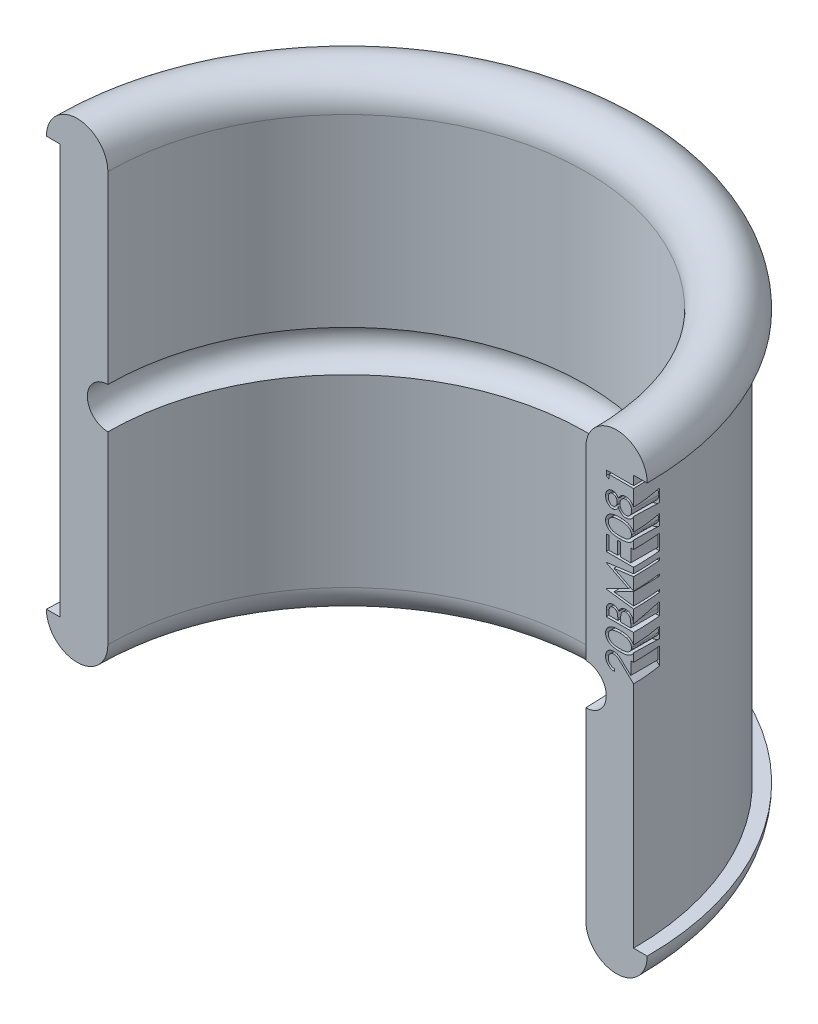
from build123d import *

# Parameters (mm, degrees)
REVOLVE2_ANGLE     = 180
CUT_EXTRUDE1_DEPTH = 2


with BuildPart() as part:
    # Sketch2 → Revolve2 (revolve)
    with BuildSketch(Plane.XY):
        with BuildLine():
            Line((2.25, 1.5), (2.25, 15))
            ThreePointArc((2.25, 15), (0, 17.25), (-2.25, 15))
            Line((-2.25, 15), (-1.25, 15))
            Line((-1.25, 15), (-1.25, -15))
            Line((-1.25, -15), (-2.25, -15))
            ThreePointArc((-2.25, -15), (0, -17.25), (2.25, -15))
            Line((2.25, -15), (2.25, -1.5))
            ThreePointArc((2.25, -1.5), (0.75, 0), (2.25, 1.5))
        make_face()
    revolve(axis=Axis((19.75, 15, 0), (0, -1, 0)), revolution_arc=REVOLVE2_ANGLE)

    # Sketch3 → Cut-Extrude1 (cut)
    # profile 1 of 8: a face of its own
    with BuildSketch(Plane.XY):
        Polygon((38.75, 13.963541667), (38.75, 14.333333333), (40.75, 14.333333333), (40.75, 14.153846154), (38.955128205, 14.153846154), (38.955128205, 13.846153846), align=None)
    # profile 2 of 8: a face of its own
    with BuildSketch(Plane.XY):
        with BuildLine():
            add(Edge.make_bspline(
                [(39.635817308, 12.972355769), (39.64434117, 12.988734612), (39.660965548, 13.020678826), (39.687901675, 13.065973436), (39.715558617, 13.107942106), (39.744464782, 13.146355068), (39.773973157, 13.181703774), (39.804463295, 13.213466849), (39.835893971, 13.241778532), (39.868381413, 13.266593709), (39.901931334, 13.288555101), (39.936757023, 13.307185161), (39.972388611, 13.32343743), (40.009358204, 13.336195151), (40.047160961, 13.346727636), (40.086303507, 13.353969282), (40.126522903, 13.357865083), (40.153704821, 13.358601491), (40.167467949, 13.358974359)],
                knots=[0, 0, 0, 0, 1.272232798, 2.48127884, 3.629933602, 4.734339846, 5.792529071, 6.8014233, 7.765980239, 8.70477066, 9.616091719, 10.526157162, 11.424183119, 12.311964017, 13.218439077, 14.126407968, 15.05133675, 16, 16, 16, 16], degree=3))
            add(Edge.make_bspline(
                [(40.167467949, 13.358974359), (40.186723313, 13.358532114), (40.224836905, 13.357656745), (40.281098843, 13.350077594), (40.335832969, 13.338595165), (40.388933056, 13.322245789), (40.43989639, 13.300397033), (40.489017721, 13.273972811), (40.53713485, 13.243888868), (40.566747057, 13.219747521), (40.581730769, 13.207532051)],
                knots=[0, 0, 0, 0, 1.025234619, 2.029323995, 3.018511574, 4.001747246, 4.983437759, 5.966776356, 6.971193253, 8, 8, 8, 8], degree=3))
            add(Edge.make_bspline(
                [(40.581730769, 13.207532051), (40.599212926, 13.191625495), (40.633961207, 13.160008943), (40.679075956, 13.10584727), (40.716989895, 13.046406193), (40.747888121, 12.981915718), (40.771937183, 12.912548231), (40.789218622, 12.838318514), (40.799117153, 12.759081855), (40.800548004, 12.704621586), (40.801282051, 12.676682692)],
                knots=[0, 0, 0, 0, 0.954267603, 1.896743057, 2.838368354, 3.796610408, 4.779680527, 5.799409237, 6.871065594, 8, 8, 8, 8], degree=3))
            add(Edge.make_bspline(
                [(40.801282051, 12.676682692), (40.800623492, 12.649817899), (40.799342004, 12.59754174), (40.790659472, 12.521451523), (40.775443547, 12.450524058), (40.75461806, 12.384346922), (40.727526485, 12.323319135), (40.693807454, 12.267614371), (40.654817838, 12.216429739), (40.60943919, 12.171315615), (40.560831684, 12.131271831), (40.510698567, 12.096066139), (40.459078461, 12.066968587), (40.406756018, 12.041888877), (40.352671215, 12.023224695), (40.297379048, 12.009986827), (40.241036607, 12.001671599), (40.203019608, 12.000559479), (40.183894231, 12)],
                knots=[0, 0, 0, 0, 1.25688423, 2.445769047, 3.576901867, 4.645929967, 5.686364546, 6.692558921, 7.686102643, 8.689032542, 9.678639083, 10.630214757, 11.550908986, 12.44815258, 13.341318614, 14.221806242, 15.105436345, 16, 16, 16, 16], degree=3))
            add(Edge.make_bspline(
                [(40.183894231, 12), (40.169860449, 12.000330315), (40.142124743, 12.000983133), (40.101147373, 12.005498789), (40.061266129, 12.012765953), (40.022320195, 12.022609315), (39.984527671, 12.03608789), (39.947646416, 12.052020247), (39.911918272, 12.070961056), (39.877078506, 12.092705242), (39.843542965, 12.118020095), (39.810770369, 12.146705514), (39.779172802, 12.1791438), (39.74893235, 12.2155667), (39.718484964, 12.254695304), (39.690085937, 12.298184642), (39.661586421, 12.344653504), (39.644554393, 12.377686271), (39.635817308, 12.39463141)],
                knots=[0, 0, 0, 0, 0.941515718, 1.860767376, 2.762381872, 3.659935523, 4.55260077, 5.451495189, 6.353332278, 7.263234701, 8.204067976, 9.169206831, 10.183030162, 11.238523545, 12.34427893, 13.507326683, 14.721309093, 16, 16, 16, 16], degree=3))
            add(Edge.make_bspline(
                [(39.635817308, 12.39463141), (39.623130164, 12.371466976), (39.598602716, 12.326684284), (39.554134582, 12.266782035), (39.504920701, 12.216122297), (39.451465746, 12.174664458), (39.394836693, 12.142194508), (39.335504975, 12.119890913), (39.27452231, 12.10480908), (39.232861898, 12.103314643), (39.211939103, 12.102564103)],
                knots=[0, 0, 0, 0, 1.166795445, 2.255709742, 3.287146686, 4.280506455, 5.237809939, 6.161201476, 7.076514059, 8, 8, 8, 8], degree=3))
            add(Edge.make_bspline(
                [(39.211939103, 12.102564103), (39.190627173, 12.10350027), (39.147786478, 12.105382131), (39.083996756, 12.120547355), (39.021308949, 12.145446277), (38.95987701, 12.178738361), (38.902466684, 12.221084006), (38.850734094, 12.271216712), (38.805433037, 12.328732839), (38.767383976, 12.393100787), (38.736423405, 12.462380826), (38.7150639, 12.53547494), (38.701100513, 12.611113091), (38.699519553, 12.662597481), (38.698717949, 12.688701923)],
                knots=[0, 0, 0, 0, 0.888671842, 1.786385383, 2.719922424, 3.697584571, 4.694127107, 5.68736021, 6.695307759, 7.740011808, 8.800474061, 9.853175224, 10.911482437, 12, 12, 12, 12], degree=3))
            add(Edge.make_bspline(
                [(38.698717949, 12.688701923), (38.6995444, 12.714132707), (38.701174066, 12.764279314), (38.714767015, 12.837990067), (38.737467918, 12.90852031), (38.768272617, 12.975616364), (38.806184957, 13.038115619), (38.85214883, 13.093156016), (38.903271186, 13.142177055), (38.961008596, 13.182499068), (39.022204254, 13.21553106), (39.086063548, 13.23878782), (39.151300769, 13.253598889), (39.195435551, 13.255471857), (39.217548077, 13.256410256)],
                knots=[0, 0, 0, 0, 1.072838999, 2.115516285, 3.151283082, 4.193045685, 5.225601509, 6.226687556, 7.21162948, 8.206378771, 9.189883966, 10.138656908, 11.067424936, 12, 12, 12, 12], degree=3))
            add(Edge.make_bspline(
                [(39.217548077, 13.256410256), (39.239246994, 13.25558543), (39.281862435, 13.253965518), (39.343898556, 13.240521617), (39.401867862, 13.217519231), (39.456703744, 13.186521239), (39.507294825, 13.14577105), (39.554703974, 13.096566233), (39.598386925, 13.038391393), (39.623079548, 12.994828046), (39.635817308, 12.972355769)],
                knots=[0, 0, 0, 0, 0.97540661, 1.915643144, 2.83819279, 3.771804602, 4.738123289, 5.749225578, 6.838931607, 8, 8, 8, 8], degree=3))
        make_face()
        with BuildLine():
            add(Edge.make_bspline(
                [(38.903846154, 12.678685897), (38.904217201, 12.664656375), (38.90494313, 12.637208495), (38.908764945, 12.596970408), (38.916106051, 12.558675775), (38.926163269, 12.522115188), (38.938676462, 12.487163404), (38.95516302, 12.45462193), (38.973487899, 12.423397186), (38.994982147, 12.394513528), (39.018432836, 12.368366485), (39.042923388, 12.345012565), (39.069175772, 12.325986369), (39.095876616, 12.309617435), (39.124133405, 12.297461215), (39.153327449, 12.288825855), (39.183643658, 12.282714544), (39.204296375, 12.282274088), (39.21474359, 12.282051282)],
                knots=[0, 0, 0, 0, 1.20353747, 2.354645537, 3.462130888, 4.543058862, 5.604822423, 6.639552563, 7.666902586, 8.706944258, 9.720926464, 10.677177239, 11.602682187, 12.496457588, 13.358248655, 14.231532794, 15.105417644, 16, 16, 16, 16], degree=3))
            add(Edge.make_bspline(
                [(39.21474359, 12.282051282), (39.225189595, 12.282444063), (39.245832403, 12.283220255), (39.276315755, 12.289223185), (39.306270976, 12.298169959), (39.334985782, 12.312256052), (39.363456273, 12.329151114), (39.390970893, 12.350003386), (39.417625399, 12.374854259), (39.44319308, 12.402869939), (39.46713523, 12.433390818), (39.487919905, 12.465724557), (39.505310826, 12.499465352), (39.519784771, 12.534266534), (39.531036164, 12.57048279), (39.539018248, 12.607892203), (39.543979389, 12.646501062), (39.544571972, 12.672661394), (39.544871795, 12.685897436)],
                knots=[0, 0, 0, 0, 0.873023192, 1.725219244, 2.590779336, 3.480155217, 4.391973325, 5.357036234, 6.360879153, 7.436073238, 8.526419356, 9.601555421, 10.645666583, 11.697338044, 12.750135903, 13.812665442, 14.89329948, 16, 16, 16, 16], degree=3))
            add(Edge.make_bspline(
                [(39.544871795, 12.685897436), (39.544375529, 12.702898513), (39.543387899, 12.736732749), (39.534121462, 12.786591601), (39.51972981, 12.835192464), (39.499303461, 12.881615724), (39.474398834, 12.925030515), (39.445029308, 12.964212362), (39.410505164, 12.997521575), (39.372829062, 13.025859239), (39.33286382, 13.048015281), (39.292593574, 13.064987156), (39.25168662, 13.074982092), (39.224275815, 13.076281352), (39.210737179, 13.076923077)],
                knots=[0, 0, 0, 0, 1.076561449, 2.142489767, 3.202892658, 4.283174188, 5.348766409, 6.369549039, 7.375093932, 8.378927502, 9.349008457, 10.26378795, 11.142457041, 12, 12, 12, 12], degree=3))
            add(Edge.make_bspline(
                [(39.210737179, 13.076923077), (39.201233908, 13.076623972), (39.182371278, 13.07603029), (39.154416964, 13.070964805), (39.127113703, 13.063001452), (39.100405054, 13.051604418), (39.074419817, 13.03696845), (39.048467884, 13.019859248), (39.023749134, 12.998626194), (38.999405387, 12.974999925), (38.976942118, 12.948148418), (38.957039639, 12.918328191), (38.940812286, 12.885191742), (38.927029002, 12.849449244), (38.916820261, 12.810715525), (38.90912965, 12.769354609), (38.904805787, 12.724984512), (38.904172969, 12.694453489), (38.903846154, 12.678685897)],
                knots=[0, 0, 0, 0, 0.814197944, 1.616066217, 2.427603245, 3.248455667, 4.099186941, 4.981981106, 5.90846497, 6.888109974, 7.887887681, 8.904052014, 9.953721043, 11.044545063, 12.183287691, 13.382474488, 14.648192314, 16, 16, 16, 16], degree=3))
        make_face(mode=Mode.SUBTRACT)
        with BuildLine():
            add(Edge.make_bspline(
                [(39.75, 12.690304487), (39.750316575, 12.672518435), (39.750937618, 12.63762654), (39.757842953, 12.586506727), (39.767470491, 12.537453485), (39.78202067, 12.490598574), (39.801108511, 12.446142716), (39.823359885, 12.40332559), (39.850441067, 12.363191872), (39.881209742, 12.325823567), (39.914388369, 12.291533693), (39.949875719, 12.261867909), (39.986297173, 12.236292779), (40.024483376, 12.215839494), (40.063591255, 12.199026793), (40.104625499, 12.187991876), (40.146789209, 12.18091619), (40.17545217, 12.179966172), (40.189903846, 12.179487179)],
                knots=[0, 0, 0, 0, 1.140120093, 2.236637429, 3.303440304, 4.343881959, 5.376465234, 6.40341898, 7.434544382, 8.475444373, 9.50525236, 10.49018835, 11.438301835, 12.354413346, 13.264416842, 14.162243115, 15.073415118, 16, 16, 16, 16], degree=3))
            add(Edge.make_bspline(
                [(40.189903846, 12.179487179), (40.207860075, 12.180282732), (40.243615215, 12.181866866), (40.296345169, 12.193918777), (40.347233929, 12.213865208), (40.396044546, 12.241173468), (40.441691085, 12.275197307), (40.481582414, 12.316831921), (40.51645647, 12.364099759), (40.545202132, 12.417719841), (40.567865942, 12.476579452), (40.584283232, 12.540145743), (40.594526275, 12.607973753), (40.595602773, 12.654743733), (40.596153846, 12.678685897)],
                knots=[0, 0, 0, 0, 0.898929492, 1.789983246, 2.69439732, 3.628772362, 4.584083338, 5.535003999, 6.506411961, 7.518169435, 8.572915583, 9.658441722, 10.801325702, 12, 12, 12, 12], degree=3))
            add(Edge.make_bspline(
                [(40.596153846, 12.678685897), (40.595789913, 12.697398927), (40.595080855, 12.733857911), (40.588965153, 12.787070183), (40.57894527, 12.837157711), (40.565493725, 12.884529522), (40.547326341, 12.928790048), (40.525119375, 12.970129882), (40.499607942, 13.009068836), (40.469417386, 13.043853716), (40.437139709, 13.075528431), (40.402974912, 13.103147815), (40.367845739, 13.127123467), (40.33095981, 13.145941179), (40.293024414, 13.160984747), (40.25368984, 13.171798208), (40.21283542, 13.178470331), (40.185121665, 13.179145128), (40.171073718, 13.179487179)],
                knots=[0, 0, 0, 0, 1.224881218, 2.3864614, 3.501053153, 4.5663711, 5.605533372, 6.626474706, 7.635288001, 8.646258782, 9.635558885, 10.592810877, 11.51917626, 12.414699553, 13.29797396, 14.186770504, 15.080884095, 16, 16, 16, 16], degree=3))
            add(Edge.make_bspline(
                [(40.171073718, 13.179487179), (40.157429499, 13.17896958), (40.130525484, 13.177948963), (40.090659243, 13.17147045), (40.05214203, 13.160091487), (40.014518477, 13.144469978), (39.97852023, 13.123703494), (39.943246834, 13.09907424), (39.909301731, 13.069809286), (39.877158178, 13.036268534), (39.847453139, 12.999896082), (39.821052223, 12.961355068), (39.799475178, 12.920462797), (39.781348761, 12.878031177), (39.767222773, 12.833631967), (39.757317435, 12.787479452), (39.751091939, 12.739486161), (39.750368092, 12.706883589), (39.75, 12.690304487)],
                knots=[0, 0, 0, 0, 0.917285732, 1.808727228, 2.70647511, 3.61182169, 4.540502712, 5.494399442, 6.50027777, 7.547876848, 8.61347749, 9.654284431, 10.682470341, 11.71628462, 12.752590585, 13.809114363, 14.885888007, 16, 16, 16, 16], degree=3))
        make_face(mode=Mode.SUBTRACT)
    # profile 3 of 8: a face of its own
    with BuildSketch(Plane.XY):
        with BuildLine():
            add(Edge.make_bspline(
                [(39.750801282, 10.461538462), (39.718745632, 10.4617259), (39.656477069, 10.462090003), (39.565742988, 10.46614053), (39.480622823, 10.472869297), (39.4011125, 10.482090653), (39.32719149, 10.493312355), (39.259057348, 10.508292637), (39.1963947, 10.52532851), (39.138999296, 10.545072813), (39.086097571, 10.567351382), (39.036712379, 10.591600124), (38.99091473, 10.618777903), (38.947986925, 10.647343659), (38.908584592, 10.678409455), (38.872253741, 10.71130918), (38.839300758, 10.746700834), (38.809703077, 10.78424115), (38.783750229, 10.823675699), (38.760749287, 10.863926884), (38.741803534, 10.905713902), (38.726305387, 10.948486652), (38.713653892, 10.992335283), (38.70496361, 11.037248599), (38.699505422, 11.083330714), (38.69898293, 11.114434209), (38.698717949, 11.130208333)],
                knots=[0, 0, 0, 0, 1.646148282, 3.197666765, 4.66315463, 6.030252048, 7.307778049, 8.501004361, 9.610818041, 10.641065266, 11.615491391, 12.557119604, 13.464013759, 14.348536654, 15.203310953, 16.038349431, 16.863300206, 17.683791446, 18.490318933, 19.285717724, 20.06220424, 20.843281102, 21.620494212, 22.403315558, 23.190242141, 24, 24, 24, 24], degree=3))
            add(Edge.make_bspline(
                [(38.698717949, 11.130208333), (38.698938663, 11.146122035), (38.699377807, 11.1777847), (38.705559017, 11.224427642), (38.713537285, 11.270258143), (38.726333112, 11.314580865), (38.741644979, 11.358233864), (38.761848744, 11.400131579), (38.783821908, 11.44175322), (38.810627319, 11.481207972), (38.840251709, 11.51967467), (38.873882966, 11.555733183), (38.91059034, 11.590305263), (38.951192514, 11.622085137), (38.995066935, 11.652434845), (39.042581398, 11.680202282), (39.093630604, 11.70596496), (39.147977896, 11.730207148), (39.207074976, 11.751406302), (39.270553238, 11.770254044), (39.338987509, 11.785702958), (39.411996567, 11.798478938), (39.489942097, 11.808395531), (39.572666174, 11.815612659), (39.660220549, 11.819426284), (39.720082196, 11.820144338), (39.750801282, 11.820512821)],
                knots=[0, 0, 0, 0, 0.810910589, 1.61342667, 2.396193133, 3.181089899, 3.963115317, 4.752255436, 5.550715454, 6.36105385, 7.181178335, 8.024612154, 8.872680183, 9.750181803, 10.651284446, 11.591556747, 12.554036451, 13.566402641, 14.62422919, 15.753422176, 16.94128843, 18.199818041, 19.531985927, 20.947085226, 22.433341622, 24, 24, 24, 24], degree=3))
            add(Edge.make_bspline(
                [(39.750801282, 11.820512821), (39.781386104, 11.820136231), (39.841112781, 11.81940082), (39.928277311, 11.815694451), (40.010555487, 11.80821925), (40.088035029, 11.799005124), (40.16075186, 11.786086347), (40.228658598, 11.770520291), (40.291995663, 11.752785084), (40.350309255, 11.73126058), (40.404562238, 11.707582648), (40.455236082, 11.681847616), (40.502737997, 11.654236875), (40.546728144, 11.624342342), (40.587167347, 11.592039722), (40.624000621, 11.557491873), (40.657845787, 11.521118527), (40.68779655, 11.482427575), (40.714806044, 11.442605326), (40.737576602, 11.400979457), (40.757305954, 11.358615285), (40.773436518, 11.315089843), (40.78594596, 11.270470334), (40.79454552, 11.22460842), (40.80059035, 11.177778118), (40.801050686, 11.146119833), (40.801282051, 11.130208333)],
                knots=[0, 0, 0, 0, 1.561645053, 3.049612875, 4.452756685, 5.778837748, 7.032101753, 8.221335837, 9.334924186, 10.387562255, 11.392109817, 12.355697819, 13.287721948, 14.19548756, 15.068665045, 15.927346723, 16.771751757, 17.602390507, 18.423119567, 19.225778204, 20.022010933, 20.807278863, 21.593079439, 22.384715467, 23.188155646, 24, 24, 24, 24], degree=3))
            add(Edge.make_bspline(
                [(40.801282051, 11.130208333), (40.801015562, 11.114434554), (40.800490098, 11.08333174), (40.795053681, 11.037244639), (40.786313393, 10.992511815), (40.774075334, 10.948912525), (40.759095423, 10.906223095), (40.73957905, 10.865025191), (40.717102374, 10.824860898), (40.69150524, 10.785836781), (40.662177608, 10.748688391), (40.629744516, 10.713198077), (40.593374271, 10.680290239), (40.553639484, 10.649493811), (40.510647809, 10.620626063), (40.464370397, 10.593683136), (40.414728227, 10.568925879), (40.361408415, 10.546266686), (40.303605644, 10.526176782), (40.240783264, 10.508499629), (40.172303184, 10.494381429), (40.098513093, 10.482414072), (40.019263055, 10.472824473), (39.934524398, 10.466143324), (39.844458033, 10.462093078), (39.782589891, 10.461726707), (39.750801282, 10.461538462)],
                knots=[0, 0, 0, 0, 0.810927267, 1.598990287, 2.382942141, 3.152806972, 3.926217614, 4.706701772, 5.493896336, 6.292070767, 7.104102563, 7.925577746, 8.761822141, 9.623241997, 10.509042271, 11.423174113, 12.375371989, 13.360203808, 14.400680605, 15.520553799, 16.714061498, 17.994519714, 19.364400916, 20.818312473, 22.365209998, 24, 24, 24, 24], degree=3))
        make_face()
        with BuildLine():
            add(Edge.make_bspline(
                [(39.75, 10.641025641), (39.776713435, 10.641095393), (39.828558968, 10.641230768), (39.903766296, 10.644665001), (39.974030029, 10.649445103), (40.039322744, 10.655458747), (40.099416245, 10.664465033), (40.154560362, 10.674683215), (40.204653025, 10.6869393), (40.250131984, 10.701511954), (40.291641239, 10.718111624), (40.33028716, 10.736203725), (40.366527772, 10.755812013), (40.40027515, 10.777338415), (40.43111677, 10.801208523), (40.459834396, 10.826315716), (40.485429254, 10.853791059), (40.516131404, 10.891791508), (40.547856109, 10.94196172), (40.575482602, 11.005173168), (40.592843966, 11.070126629), (40.595051832, 11.114213049), (40.596153846, 11.136217949)],
                knots=[0, 0, 0, 0, 1.459098681, 2.831824031, 4.11146945, 5.306290378, 6.412266529, 7.42953815, 8.369053297, 9.227277979, 10.03601793, 10.809473603, 11.557037441, 12.285528272, 12.993193355, 13.685654407, 14.36688038, 15.041354379, 16.352855396, 17.594313975, 18.799247529, 20, 20, 20, 20], degree=3))
            add(Edge.make_bspline(
                [(40.596153846, 11.136217949), (40.595188901, 11.158350226), (40.593262434, 11.202536272), (40.576448986, 11.267430067), (40.549115659, 11.329908059), (40.517887981, 11.379215028), (40.487958443, 11.416622799), (40.462470054, 11.443434739), (40.433922261, 11.468041004), (40.403123103, 11.491379504), (40.369481561, 11.512784643), (40.333160124, 11.532249306), (40.294057727, 11.550011215), (40.266760735, 11.560130671), (40.252804487, 11.565304487)],
                knots=[0, 0, 0, 0, 1.353621445, 2.702441307, 4.075953605, 5.516772412, 6.261413105, 7.007624062, 7.778524365, 8.566925914, 9.372323995, 10.217594641, 11.088702136, 12, 12, 12, 12], degree=3))
            add(Edge.make_bspline(
                [(40.252804487, 11.565304487), (40.234958922, 11.571334069), (40.198724771, 11.583576705), (40.14251697, 11.599354862), (40.083543962, 11.611780804), (40.022158181, 11.622959871), (39.957906923, 11.630590188), (39.890988989, 11.636731796), (39.821353925, 11.640349331), (39.774042502, 11.64079776), (39.75, 11.641025641)],
                knots=[0, 0, 0, 0, 0.884706709, 1.796334032, 2.740027952, 3.714592787, 4.726048262, 5.777819803, 6.87074269, 8, 8, 8, 8], degree=3))
            add(Edge.make_bspline(
                [(39.75, 11.641025641), (39.725961387, 11.640711247), (39.678936722, 11.640096226), (39.61006919, 11.637745375), (39.544659041, 11.631674762), (39.482424485, 11.624932408), (39.423710025, 11.61499114), (39.368024141, 11.604272388), (39.316056682, 11.589871711), (39.26699412, 11.574488928), (39.221393551, 11.556883177), (39.17904349, 11.537502103), (39.139735578, 11.516806243), (39.103591268, 11.494316967), (39.070400906, 11.470347527), (39.040928201, 11.444038515), (39.013739466, 11.417060748), (38.983258888, 11.378692675), (38.951935062, 11.328870566), (38.923893125, 11.26644739), (38.907297151, 11.201842094), (38.904995657, 11.158076891), (38.903846154, 11.136217949)],
                knots=[0, 0, 0, 0, 1.313483664, 2.569454835, 3.763100662, 4.901599063, 5.988328865, 7.015709358, 7.99797933, 8.932480776, 9.824041341, 10.666387587, 11.475829342, 12.24921787, 12.990555181, 13.709176526, 14.405678811, 15.080244297, 16.38186033, 17.610124501, 18.806354173, 20, 20, 20, 20], degree=3))
            add(Edge.make_bspline(
                [(38.903846154, 11.136217949), (38.904998517, 11.11409425), (38.907305341, 11.069806549), (38.923816374, 11.004511329), (38.951853017, 10.941666447), (38.983198539, 10.891680042), (39.013622601, 10.853778077), (39.03951698, 10.826881954), (39.067548699, 10.801426559), (39.098663919, 10.778174564), (39.132292388, 10.756775808), (39.168064346, 10.736409729), (39.206782476, 10.718559567), (39.248259182, 10.701906605), (39.293740643, 10.687309645), (39.344014558, 10.675193598), (39.399290363, 10.664163371), (39.459822942, 10.656219809), (39.525129592, 10.649224975), (39.595573013, 10.644717478), (39.671038596, 10.641215036), (39.723152369, 10.641090037), (39.75, 10.641025641)],
                knots=[0, 0, 0, 0, 1.207546505, 2.417292871, 3.651582144, 4.952510111, 5.626719005, 6.30238548, 6.989136872, 7.692112372, 8.420316868, 9.164734959, 9.937886623, 10.746308695, 11.604196049, 12.543341915, 13.568754172, 14.680483261, 15.875568977, 17.154711427, 18.534182925, 20, 20, 20, 20], degree=3))
        make_face(mode=Mode.SUBTRACT)
    # profile 4 of 8: a face of its own
    with BuildSketch(Plane.XY):
        Polygon((38.75, 9.153846154), (38.75, 10.282051282), (38.955128205, 10.282051282), (38.955128205, 9.333333333), (39.570512821, 9.333333333), (39.570512821, 10.282051282), (39.775641026, 10.282051282), (39.775641026, 9.333333333), (40.544871795, 9.333333333), (40.544871795, 10.282051282), (40.75, 10.282051282), (40.75, 9.153846154), align=None)
    # profile 5 of 8: a face of its own
    with BuildSketch(Plane.XY):
        Polygon((40.75, 6.512820513), (38.75, 6.776842949), (38.75, 6.802483974), (40.391025641, 7.628205128), (38.75, 8.451923077), (38.75, 8.477964744), (40.75, 8.743589744), (40.75, 8.563301282), (39.310897436, 8.371794872), (40.75, 7.649839744), (40.75, 7.609375), (39.307692308, 6.884615385), (40.75, 6.693509615), align=None)
    # profile 6 of 8: a face of its own
    with BuildSketch(Plane.XY):
        with BuildLine():
            Line((38.75, 5.025641026), (38.75, 5.415865385))
            add(Edge.make_bspline(
                [(38.75, 5.415865385), (38.750098848, 5.434967673), (38.750290439, 5.471992663), (38.753330858, 5.52582825), (38.757372808, 5.576270324), (38.76415296, 5.623229749), (38.771183084, 5.667012081), (38.781501623, 5.707172838), (38.792898825, 5.744048417), (38.810434967, 5.788328439), (38.837668817, 5.838570192), (38.878059204, 5.892570675), (38.926484017, 5.93951119), (38.98166791, 5.979424541), (39.042376447, 6.011455855), (39.107303463, 6.034335932), (39.175356638, 6.049034965), (39.222013382, 6.050527665), (39.245592949, 6.051282051)],
                knots=[0, 0, 0, 0, 1.00128172, 1.940733171, 2.826250472, 3.653024905, 4.427672124, 5.149348099, 5.824709082, 6.450061444, 7.643590664, 8.808605388, 9.972104426, 11.165284501, 12.367876273, 13.557044126, 14.765369432, 16, 16, 16, 16], degree=3))
            add(Edge.make_bspline(
                [(39.245592949, 6.051282051), (39.267679152, 6.050653702), (39.311080625, 6.049418937), (39.37445082, 6.037755526), (39.43471217, 6.019244024), (39.491813102, 5.993660383), (39.544690677, 5.960697293), (39.593181093, 5.921202877), (39.635451681, 5.873750652), (39.659074431, 5.838180304), (39.671073718, 5.820112179)],
                knots=[0, 0, 0, 0, 1.044641374, 2.052818814, 3.038628718, 4.023282556, 5.005660861, 5.98021751, 6.974042014, 8, 8, 8, 8], degree=3))
            add(Edge.make_bspline(
                [(39.671073718, 5.820112179), (39.679799399, 5.84283023), (39.696493788, 5.886295488), (39.725963124, 5.946144529), (39.75813172, 5.997520236), (39.792718706, 6.041426207), (39.830549637, 6.078778823), (39.871931871, 6.111128348), (39.91683153, 6.139095143), (39.965083594, 6.162894692), (40.016279009, 6.181589534), (40.069792471, 6.195329985), (40.125418839, 6.20345776), (40.163168006, 6.204566513), (40.182291667, 6.205128205)],
                knots=[0, 0, 0, 0, 1.272586185, 2.434772614, 3.483318042, 4.437947805, 5.351807173, 6.25737843, 7.180033415, 8.1141739, 9.066731021, 10.025721652, 10.999834114, 12, 12, 12, 12], degree=3))
            add(Edge.make_bspline(
                [(40.182291667, 6.205128205), (40.201815673, 6.204570129), (40.240229703, 6.2034721), (40.296660073, 6.195367516), (40.350592785, 6.181654431), (40.40235183, 6.162733069), (40.451828689, 6.138207834), (40.498844123, 6.107930058), (40.543495947, 6.072324782), (40.585862966, 6.032085064), (40.62463012, 5.987241047), (40.657956799, 5.937820053), (40.686612993, 5.885175978), (40.709943845, 5.828635817), (40.727943581, 5.768343905), (40.740484447, 5.704333792), (40.748948642, 5.636710894), (40.749643601, 5.590304982), (40.75, 5.56650641)],
                knots=[0, 0, 0, 0, 0.978680899, 1.925582087, 2.851223405, 3.764209995, 4.683484765, 5.614004905, 6.562443559, 7.542772147, 8.539900013, 9.527881485, 10.525548727, 11.540192123, 12.58875426, 13.674701727, 14.807505862, 16, 16, 16, 16], degree=3))
            Line((40.75, 5.56650641), (40.75, 5.025641026))
            Line((40.75, 5.025641026), (38.75, 5.025641026))
        make_face()
        with BuildLine():
            Line((38.955128205, 5.205128205), (39.596153846, 5.205128205))
            Line((39.596153846, 5.205128205), (39.596153846, 5.325721154))
            add(Edge.make_bspline(
                [(39.596153846, 5.325721154), (39.595925319, 5.343349037), (39.595483757, 5.377409699), (39.59421889, 5.426735354), (39.590677152, 5.472521081), (39.587136426, 5.514687836), (39.581379535, 5.553169252), (39.57452684, 5.587879968), (39.567279639, 5.619365082), (39.554953487, 5.655672543), (39.53674263, 5.696862853), (39.508453427, 5.7407447), (39.474785704, 5.779609737), (39.435574437, 5.81203551), (39.392866471, 5.838807827), (39.347036744, 5.857562676), (39.299007519, 5.870065976), (39.265971726, 5.87121267), (39.249198718, 5.871794872)],
                knots=[0, 0, 0, 0, 1.156917035, 2.235399477, 3.236897345, 4.169954739, 5.01148057, 5.788325709, 6.491867502, 7.129259015, 8.302032419, 9.437271567, 10.542795419, 11.662606952, 12.764338259, 13.836858145, 14.901724648, 16, 16, 16, 16], degree=3))
            add(Edge.make_bspline(
                [(39.249198718, 5.871794872), (39.238096822, 5.871499265), (39.216319241, 5.870919401), (39.184469416, 5.865997788), (39.154542263, 5.858023468), (39.126250557, 5.847224089), (39.100297413, 5.832470535), (39.075442724, 5.815369227), (39.053175165, 5.794255235), (39.032422687, 5.770394549), (39.013849289, 5.743093668), (38.998464107, 5.711764395), (38.984520021, 5.677216639), (38.974197628, 5.6385131), (38.965120702, 5.59645573), (38.959417609, 5.550475055), (38.955747614, 5.500862445), (38.95533928, 5.466487138), (38.955128205, 5.448717949)],
                knots=[0, 0, 0, 0, 0.911708768, 1.788416306, 2.640049961, 3.452993646, 4.268229297, 5.087074648, 5.92553149, 6.781184137, 7.681934069, 8.628939405, 9.643570426, 10.73771997, 11.914765019, 13.176320755, 14.540391495, 16, 16, 16, 16], degree=3))
            Line((38.955128205, 5.448717949), (38.955128205, 5.205128205))
        make_face(mode=Mode.SUBTRACT)
        with BuildLine():
            Line((39.801282051, 5.205128205), (40.544871795, 5.205128205))
            Line((40.544871795, 5.205128205), (40.544871795, 5.460737179))
            add(Edge.make_bspline(
                [(40.544871795, 5.460737179), (40.544630706, 5.479031795), (40.54416604, 5.514292255), (40.543076301, 5.565242392), (40.538953985, 5.612342064), (40.535151166, 5.655739852), (40.52864851, 5.69532058), (40.522511693, 5.731388703), (40.513402026, 5.763352139), (40.500881862, 5.800756755), (40.480838632, 5.84256647), (40.451555663, 5.888256962), (40.415415959, 5.928098363), (40.37431389, 5.962298487), (40.329746704, 5.990521914), (40.282297033, 6.010774893), (40.232887682, 6.023360817), (40.199190957, 6.024879426), (40.182291667, 6.025641026)],
                knots=[0, 0, 0, 0, 1.160376723, 2.23647316, 3.230273494, 4.158083346, 4.997711197, 5.773399541, 6.476071462, 7.102777513, 8.27340052, 9.405620712, 10.53304798, 11.669441455, 12.787990954, 13.865552736, 14.929550474, 16, 16, 16, 16], degree=3))
            add(Edge.make_bspline(
                [(40.182291667, 6.025641026), (40.171723816, 6.025483735), (40.150758575, 6.025171691), (40.119952853, 6.020444295), (40.090097238, 6.013605252), (40.061067315, 6.004598035), (40.033351185, 5.992006432), (40.006842556, 5.976570181), (39.98100742, 5.95890065), (39.94792329, 5.931639906), (39.91027814, 5.891410001), (39.873876481, 5.834238818), (39.844045674, 5.76959208), (39.831434486, 5.722594858), (39.824919872, 5.698317308)],
                knots=[0, 0, 0, 0, 0.723302347, 1.434937762, 2.129609326, 2.821140842, 3.513216847, 4.209993937, 4.920569932, 5.655069131, 7.14393391, 8.6716197, 10.280644748, 12, 12, 12, 12], degree=3))
            add(Edge.make_bspline(
                [(39.824919872, 5.698317308), (39.822945538, 5.688586396), (39.818664775, 5.667487772), (39.814146088, 5.63308344), (39.810120339, 5.593805801), (39.807142535, 5.549564156), (39.80406451, 5.500302533), (39.802867469, 5.445915722), (39.801439321, 5.386625828), (39.801335815, 5.34548733), (39.801282051, 5.32411859)],
                knots=[0, 0, 0, 0, 0.634451884, 1.375622551, 2.216452059, 3.157844607, 4.20941857, 5.370758133, 6.634282058, 8, 8, 8, 8], degree=3))
            Line((39.801282051, 5.32411859), (39.801282051, 5.205128205))
        make_face(mode=Mode.SUBTRACT)
    # profile 7 of 8: a face of its own
    with BuildSketch(Plane.XY):
        with BuildLine():
            add(Edge.make_bspline(
                [(39.750801282, 3.307692308), (39.718745632, 3.307879747), (39.656477069, 3.308243849), (39.565742988, 3.312294376), (39.480622823, 3.319023143), (39.4011125, 3.328244499), (39.32719149, 3.339466201), (39.259057348, 3.354446483), (39.1963947, 3.371482356), (39.138999296, 3.391226659), (39.086097571, 3.413505228), (39.036712379, 3.43775397), (38.99091473, 3.464931749), (38.947986925, 3.493497505), (38.908584592, 3.524563301), (38.872253741, 3.557463027), (38.839300758, 3.59285468), (38.809703077, 3.630394996), (38.783750229, 3.669829545), (38.760749287, 3.71008073), (38.741803534, 3.751867748), (38.726305387, 3.794640499), (38.713653892, 3.838489129), (38.70496361, 3.883402445), (38.699505422, 3.92948456), (38.69898293, 3.960588055), (38.698717949, 3.976362179)],
                knots=[0, 0, 0, 0, 1.646148282, 3.197666765, 4.66315463, 6.030252048, 7.307778049, 8.501004361, 9.610818041, 10.641065266, 11.615491391, 12.557119604, 13.464013759, 14.348536654, 15.203310953, 16.038349431, 16.863300206, 17.683791446, 18.490318933, 19.285717724, 20.06220424, 20.843281102, 21.620494212, 22.403315558, 23.190242141, 24, 24, 24, 24], degree=3))
            add(Edge.make_bspline(
                [(38.698717949, 3.976362179), (38.698938663, 3.992275881), (38.699377807, 4.023938546), (38.705559017, 4.070581488), (38.713537285, 4.116411989), (38.726333112, 4.160734711), (38.741644979, 4.204387711), (38.761848744, 4.246285425), (38.783821908, 4.287907066), (38.810627319, 4.327361818), (38.840251709, 4.365828516), (38.873882966, 4.401887029), (38.91059034, 4.43645911), (38.951192514, 4.468238983), (38.995066935, 4.498588691), (39.042581398, 4.526356128), (39.093630604, 4.552118806), (39.147977896, 4.576360994), (39.207074976, 4.597560148), (39.270553238, 4.61640789), (39.338987509, 4.631856804), (39.411996567, 4.644632784), (39.489942097, 4.654549377), (39.572666174, 4.661766505), (39.660220549, 4.665580131), (39.720082196, 4.666298184), (39.750801282, 4.666666667)],
                knots=[0, 0, 0, 0, 0.810910589, 1.61342667, 2.396193133, 3.181089899, 3.963115317, 4.752255436, 5.550715454, 6.36105385, 7.181178335, 8.024612154, 8.872680183, 9.750181803, 10.651284446, 11.591556747, 12.554036451, 13.566402641, 14.62422919, 15.753422176, 16.94128843, 18.199818041, 19.531985927, 20.947085226, 22.433341622, 24, 24, 24, 24], degree=3))
            add(Edge.make_bspline(
                [(39.750801282, 4.666666667), (39.781386104, 4.666290078), (39.841112781, 4.665554666), (39.928277311, 4.661848297), (40.010555487, 4.654373096), (40.088035029, 4.64515897), (40.16075186, 4.632240194), (40.228658598, 4.616674137), (40.291995663, 4.59893893), (40.350309255, 4.577414426), (40.404562238, 4.553736494), (40.455236082, 4.528001462), (40.502737997, 4.500390721), (40.546728144, 4.470496188), (40.587167347, 4.438193568), (40.624000621, 4.40364572), (40.657845787, 4.367272373), (40.68779655, 4.328581421), (40.714806044, 4.288759172), (40.737576602, 4.247133303), (40.757305954, 4.204769131), (40.773436518, 4.161243689), (40.78594596, 4.11662418), (40.79454552, 4.070762266), (40.80059035, 4.023931964), (40.801050686, 3.992273679), (40.801282051, 3.976362179)],
                knots=[0, 0, 0, 0, 1.561645053, 3.049612875, 4.452756685, 5.778837748, 7.032101753, 8.221335837, 9.334924186, 10.387562255, 11.392109817, 12.355697819, 13.287721948, 14.19548756, 15.068665045, 15.927346723, 16.771751757, 17.602390507, 18.423119567, 19.225778204, 20.022010933, 20.807278863, 21.593079439, 22.384715467, 23.188155646, 24, 24, 24, 24], degree=3))
            add(Edge.make_bspline(
                [(40.801282051, 3.976362179), (40.801015562, 3.9605884), (40.800490098, 3.929485586), (40.795053681, 3.883398486), (40.786313393, 3.838665661), (40.774075334, 3.795066371), (40.759095423, 3.752376941), (40.73957905, 3.711179037), (40.717102374, 3.671014744), (40.69150524, 3.631990627), (40.662177608, 3.594842237), (40.629744516, 3.559351923), (40.593374271, 3.526444085), (40.553639484, 3.495647657), (40.510647809, 3.466779909), (40.464370397, 3.439836982), (40.414728227, 3.415079725), (40.361408415, 3.392420532), (40.303605644, 3.372330628), (40.240783264, 3.354653475), (40.172303184, 3.340535275), (40.098513093, 3.328567919), (40.019263055, 3.318978319), (39.934524398, 3.31229717), (39.844458033, 3.308246925), (39.782589891, 3.307880554), (39.750801282, 3.307692308)],
                knots=[0, 0, 0, 0, 0.810927267, 1.598990287, 2.382942141, 3.152806972, 3.926217614, 4.706701772, 5.493896336, 6.292070767, 7.104102563, 7.925577746, 8.761822141, 9.623241997, 10.509042271, 11.423174113, 12.375371989, 13.360203808, 14.400680605, 15.520553799, 16.714061498, 17.994519714, 19.364400916, 20.818312473, 22.365209998, 24, 24, 24, 24], degree=3))
        make_face()
        with BuildLine():
            add(Edge.make_bspline(
                [(39.75, 3.487179487), (39.776713435, 3.487249239), (39.828558968, 3.487384615), (39.903766296, 3.490818847), (39.974030029, 3.495598949), (40.039322744, 3.501612593), (40.099416245, 3.510618879), (40.154560362, 3.520837061), (40.204653025, 3.533093147), (40.250131984, 3.5476658), (40.291641239, 3.56426547), (40.33028716, 3.582357571), (40.366527772, 3.601965859), (40.40027515, 3.623492261), (40.43111677, 3.647362369), (40.459834396, 3.672469562), (40.485429254, 3.699944906), (40.516131404, 3.737945355), (40.547856109, 3.788115566), (40.575482602, 3.851327014), (40.592843966, 3.916280475), (40.595051832, 3.960366896), (40.596153846, 3.982371795)],
                knots=[0, 0, 0, 0, 1.459098681, 2.831824031, 4.11146945, 5.306290378, 6.412266529, 7.42953815, 8.369053297, 9.227277979, 10.03601793, 10.809473603, 11.557037441, 12.285528272, 12.993193355, 13.685654407, 14.36688038, 15.041354379, 16.352855396, 17.594313975, 18.799247529, 20, 20, 20, 20], degree=3))
            add(Edge.make_bspline(
                [(40.596153846, 3.982371795), (40.595188901, 4.004504072), (40.593262434, 4.048690118), (40.576448986, 4.113583913), (40.549115659, 4.176061905), (40.517887981, 4.225368874), (40.487958443, 4.262776645), (40.462470054, 4.289588585), (40.433922261, 4.31419485), (40.403123103, 4.337533351), (40.369481561, 4.358938489), (40.333160124, 4.378403152), (40.294057727, 4.396165062), (40.266760735, 4.406284517), (40.252804487, 4.411458333)],
                knots=[0, 0, 0, 0, 1.353621445, 2.702441307, 4.075953605, 5.516772412, 6.261413105, 7.007624062, 7.778524365, 8.566925914, 9.372323995, 10.217594641, 11.088702136, 12, 12, 12, 12], degree=3))
            add(Edge.make_bspline(
                [(40.252804487, 4.411458333), (40.234958922, 4.417487915), (40.198724771, 4.429730551), (40.14251697, 4.445508708), (40.083543962, 4.457934651), (40.022158181, 4.469113717), (39.957906923, 4.476744034), (39.890988989, 4.482885642), (39.821353925, 4.486503177), (39.774042502, 4.486951606), (39.75, 4.487179487)],
                knots=[0, 0, 0, 0, 0.884706709, 1.796334032, 2.740027952, 3.714592787, 4.726048262, 5.777819803, 6.87074269, 8, 8, 8, 8], degree=3))
            add(Edge.make_bspline(
                [(39.75, 4.487179487), (39.725961387, 4.486865093), (39.678936722, 4.486250072), (39.61006919, 4.483899222), (39.544659041, 4.477828608), (39.482424485, 4.471086254), (39.423710025, 4.461144986), (39.368024141, 4.450426235), (39.316056682, 4.436025558), (39.26699412, 4.420642774), (39.221393551, 4.403037023), (39.17904349, 4.38365595), (39.139735578, 4.36296009), (39.103591268, 4.340470813), (39.070400906, 4.316501374), (39.040928201, 4.290192361), (39.013739466, 4.263214594), (38.983258888, 4.224846521), (38.951935062, 4.175024412), (38.923893125, 4.112601236), (38.907297151, 4.04799594), (38.904995657, 4.004230737), (38.903846154, 3.982371795)],
                knots=[0, 0, 0, 0, 1.313483664, 2.569454835, 3.763100662, 4.901599063, 5.988328865, 7.015709358, 7.99797933, 8.932480776, 9.824041341, 10.666387587, 11.475829342, 12.24921787, 12.990555181, 13.709176526, 14.405678811, 15.080244297, 16.38186033, 17.610124501, 18.806354173, 20, 20, 20, 20], degree=3))
            add(Edge.make_bspline(
                [(38.903846154, 3.982371795), (38.904998517, 3.960248096), (38.907305341, 3.915960395), (38.923816374, 3.850665175), (38.951853017, 3.787820293), (38.983198539, 3.737833888), (39.013622601, 3.699931924), (39.03951698, 3.6730358), (39.067548699, 3.647580405), (39.098663919, 3.62432841), (39.132292388, 3.602929654), (39.168064346, 3.582563575), (39.206782476, 3.564713413), (39.248259182, 3.548060451), (39.293740643, 3.533463491), (39.344014558, 3.521347444), (39.399290363, 3.510317217), (39.459822942, 3.502373655), (39.525129592, 3.495378822), (39.595573013, 3.490871324), (39.671038596, 3.487368882), (39.723152369, 3.487243883), (39.75, 3.487179487)],
                knots=[0, 0, 0, 0, 1.207546505, 2.417292871, 3.651582144, 4.952510111, 5.626719005, 6.30238548, 6.989136872, 7.692112372, 8.420316868, 9.164734959, 9.937886623, 10.746308695, 11.604196049, 12.543341915, 13.568754172, 14.680483261, 15.875568977, 17.154711427, 18.534182925, 20, 20, 20, 20], degree=3))
        make_face(mode=Mode.SUBTRACT)
    # profile 8 of 8: a face of its own
    with BuildSketch(Plane.XY):
        with BuildLine():
            Line((39.365384615, 2.025641026), (39.365384615, 1.846153846))
            add(Edge.make_bspline(
                [(39.365384615, 1.846153846), (39.34157268, 1.847323648), (39.294806671, 1.849621107), (39.226621582, 1.86038013), (39.161447411, 1.875774917), (39.09980746, 1.897541462), (39.041156713, 1.924573621), (38.985728133, 1.956990779), (38.933733168, 1.995387265), (38.885653829, 2.03893397), (38.841546646, 2.086230335), (38.803457935, 2.137262301), (38.771276409, 2.190888031), (38.744372842, 2.24694483), (38.724178644, 2.306065152), (38.70919485, 2.3677125), (38.700179796, 2.43215772), (38.699210775, 2.476066304), (38.698717949, 2.498397436)],
                knots=[0, 0, 0, 0, 1.10065271, 2.161652631, 3.183658789, 4.190468796, 5.17591951, 6.163126047, 7.15150782, 8.156236427, 9.156009102, 10.134482811, 11.092018607, 12.041330605, 13.001268258, 13.972401359, 14.968799086, 16, 16, 16, 16], degree=3))
            add(Edge.make_bspline(
                [(38.698717949, 2.498397436), (38.699227186, 2.520329307), (38.700227819, 2.563424651), (38.708950204, 2.626295398), (38.72231648, 2.686289169), (38.742123196, 2.742726055), (38.766976292, 2.796185257), (38.797884372, 2.846004862), (38.833384972, 2.893389559), (38.87525967, 2.93601379), (38.919940078, 2.975169289), (38.967658379, 3.008918961), (39.017000571, 3.037984445), (39.068352089, 3.061773635), (39.121880158, 3.079806899), (39.177071587, 3.093167819), (39.234563321, 3.100805644), (39.273482472, 3.101971416), (39.293269231, 3.102564103)],
                knots=[0, 0, 0, 0, 1.111674182, 2.184400057, 3.212814286, 4.223731311, 5.211378316, 6.196328225, 7.191884489, 8.207283132, 9.220262353, 10.201199469, 11.166417575, 12.120932471, 13.06540007, 14.026332106, 14.996573967, 16, 16, 16, 16], degree=3))
            add(Edge.make_bspline(
                [(39.293269231, 3.102564103), (39.321125124, 3.101596509), (39.37634808, 3.099678301), (39.457499606, 3.083270308), (39.536123747, 3.057642882), (39.599404363, 3.026789984), (39.650390103, 2.995656753), (39.692389969, 2.967629252), (39.737600633, 2.934631829), (39.786205084, 2.896946398), (39.837566806, 2.853923963), (39.892733715, 2.806682242), (39.950685739, 2.7540012), (39.990293538, 2.717059125), (40.010817308, 2.697916667)],
                knots=[0, 0, 0, 0, 1.184416499, 2.348048165, 3.509039915, 4.696071444, 5.333504901, 6.05069495, 6.844171097, 7.714965912, 8.667477798, 9.695072654, 10.805644396, 12, 12, 12, 12], degree=3))
            Line((40.010817308, 2.697916667), (40.544871795, 2.197516026))
            Line((40.544871795, 2.197516026), (40.544871795, 3.128205128))
            Line((40.544871795, 3.128205128), (40.75, 3.128205128))
            Line((40.75, 3.128205128), (40.75, 1.769230769))
            Line((40.75, 1.769230769), (39.922275641, 2.544871795))
            add(Edge.make_bspline(
                [(39.922275641, 2.544871795), (39.902562323, 2.563756302), (39.864697074, 2.600029574), (39.809415382, 2.651333904), (39.75812993, 2.697413326), (39.710937617, 2.738566122), (39.667148149, 2.773899553), (39.628179747, 2.805255114), (39.592320061, 2.830378309), (39.550753996, 2.85764425), (39.500004101, 2.884052239), (39.43798485, 2.906745014), (39.374140705, 2.92058207), (39.330996684, 2.922241976), (39.309294872, 2.923076923)],
                knots=[0, 0, 0, 0, 1.329631726, 2.553950428, 3.673215718, 4.687767853, 5.603093632, 6.413772471, 7.123043292, 7.734684054, 8.834405432, 9.900288307, 10.943827018, 12, 12, 12, 12], degree=3))
            add(Edge.make_bspline(
                [(39.309294872, 2.923076923), (39.295648358, 2.922713642), (39.268753701, 2.921997684), (39.229321839, 2.915679), (39.191284802, 2.906130139), (39.154525591, 2.892447135), (39.11941379, 2.87438614), (39.085906659, 2.852401352), (39.053512964, 2.827035601), (39.023139651, 2.797692019), (38.995321819, 2.765456865), (38.970679485, 2.731403008), (38.950085707, 2.695374377), (38.933203709, 2.657522878), (38.919960634, 2.617954039), (38.910784303, 2.576591327), (38.905022883, 2.533549032), (38.904243357, 2.504158463), (38.903846154, 2.489182692)],
                knots=[0, 0, 0, 0, 0.991446411, 1.95395049, 2.89581595, 3.838931463, 4.798493298, 5.75982156, 6.748411868, 7.785213223, 8.824556874, 9.840280684, 10.836137867, 11.835679398, 12.848801643, 13.863922112, 14.911575587, 16, 16, 16, 16], degree=3))
            add(Edge.make_bspline(
                [(38.903846154, 2.489182692), (38.904238621, 2.473538291), (38.905009363, 2.442815269), (38.910847343, 2.397802818), (38.919697724, 2.354566395), (38.933754061, 2.313751126), (38.950362321, 2.274473184), (38.971461326, 2.237571089), (38.995978838, 2.202432155), (39.024407893, 2.169634348), (39.056349992, 2.139679511), (39.09155239, 2.112990185), (39.129761657, 2.089823853), (39.170820977, 2.069583214), (39.215139146, 2.053153298), (39.262548774, 2.040596671), (39.312846843, 2.030661482), (39.347581158, 2.027342306), (39.365384615, 2.025641026)],
                knots=[0, 0, 0, 0, 1.030878251, 2.024474673, 2.987898669, 3.934362936, 4.864849709, 5.795128259, 6.730474222, 7.685293701, 8.650606017, 9.611896181, 10.591709709, 11.591680886, 12.625074257, 13.701333388, 14.821793024, 16, 16, 16, 16], degree=3))
        make_face()
    extrude(amount=-CUT_EXTRUDE1_DEPTH, mode=Mode.SUBTRACT)


solid = part.part
